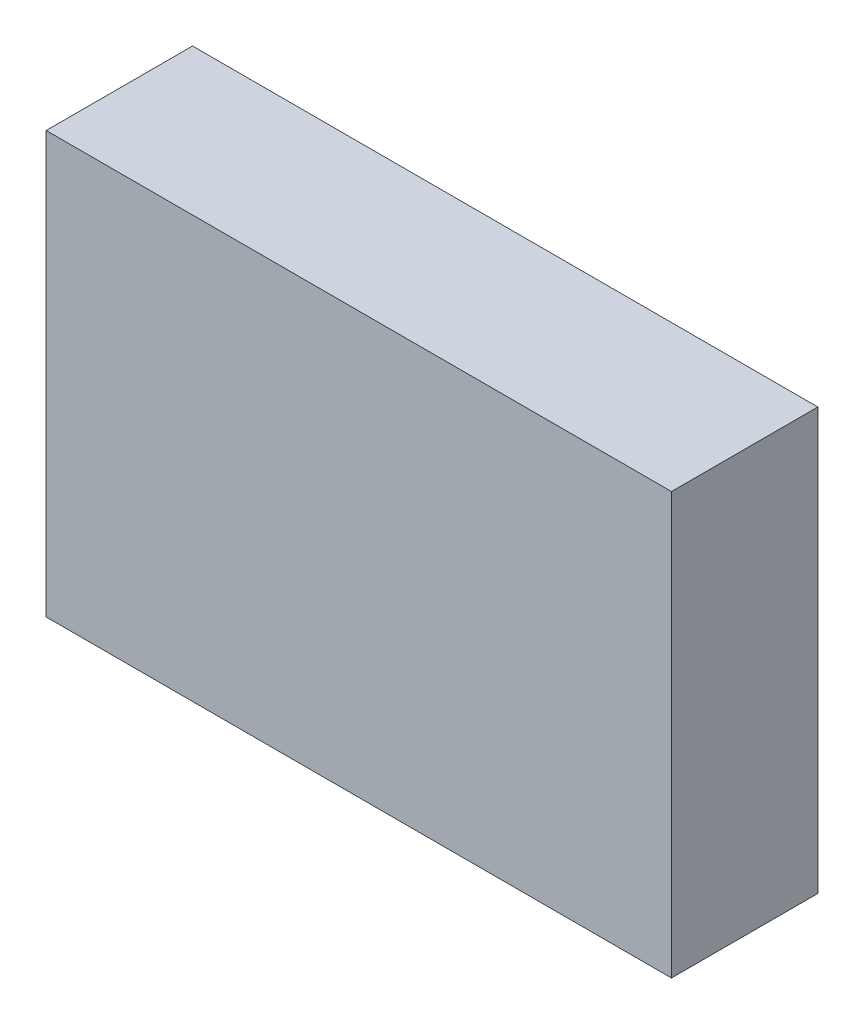
from build123d import *

# Parameters (mm, degrees)
SKETCH_1_W      = 7.05
SKETCH_1_H      = 4.75
EXTRUDE_1_DEPTH = 1.65


with BuildPart() as part:
    # 草图1 → 凸台-拉伸1 (new body)
    with BuildSketch(Plane.XY):
        with Locations((0, -0.25)):
            Rectangle(SKETCH_1_W, SKETCH_1_H)
    extrude(amount=EXTRUDE_1_DEPTH)


solid = part.part
